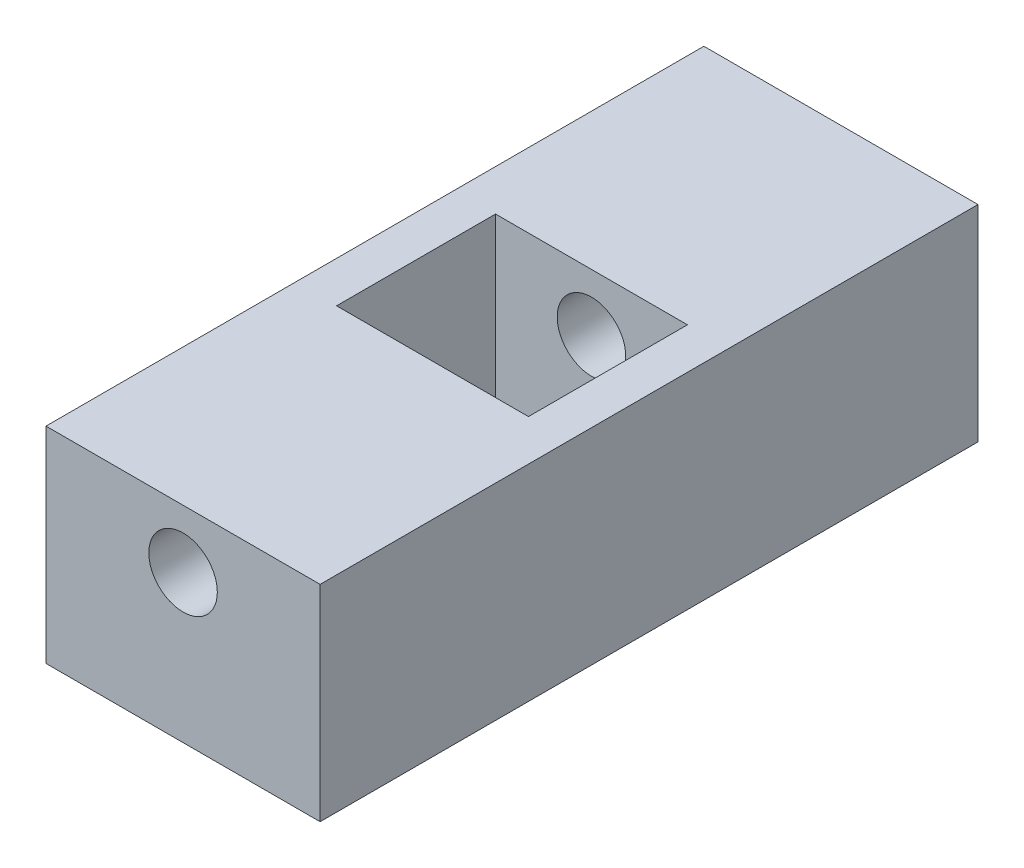
from build123d import *

# Parameters (mm, degrees)
SKETCH1_W           = 25.4
SKETCH1_H           = 60.96
BOSS_EXTRUDE1_DEPTH = 19.05
SKETCH3_W           = 17.78
SKETCH3_H           = 14.732
CUT_EXTRUDE1_DEPTH  = 19.05
SKETCH5_R           = 3.175
CUT_EXTRUDE3_DEPTH  = 58.42


with BuildPart() as part:
    # Sketch1 → Boss-Extrude1 (new body)
    with BuildSketch(Plane(origin=(0, 0, 0), x_dir=(1, 0, 0), z_dir=(0, 1, 0))):
        with Locations((12.7, 30.48)):
            Rectangle(SKETCH1_W, SKETCH1_H)
    extrude(amount=BOSS_EXTRUDE1_DEPTH)

    # Sketch3 → Cut-Extrude1 (cut)
    with BuildSketch(Plane(origin=(0, 19.05, 0), x_dir=(1, 0, 0), z_dir=(0, 1, 0))):
        with Locations((12.7, 30.48)):
            Rectangle(SKETCH3_W, SKETCH3_H)
    extrude(amount=-CUT_EXTRUDE1_DEPTH, mode=Mode.SUBTRACT)

    # Sketch5 → Cut-Extrude3 (cut)
    with BuildSketch(Plane.XY):
        with Locations((12.7, 13.6525)):
            Circle(SKETCH5_R)
    extrude(amount=-CUT_EXTRUDE3_DEPTH, mode=Mode.SUBTRACT)


solid = part.part
